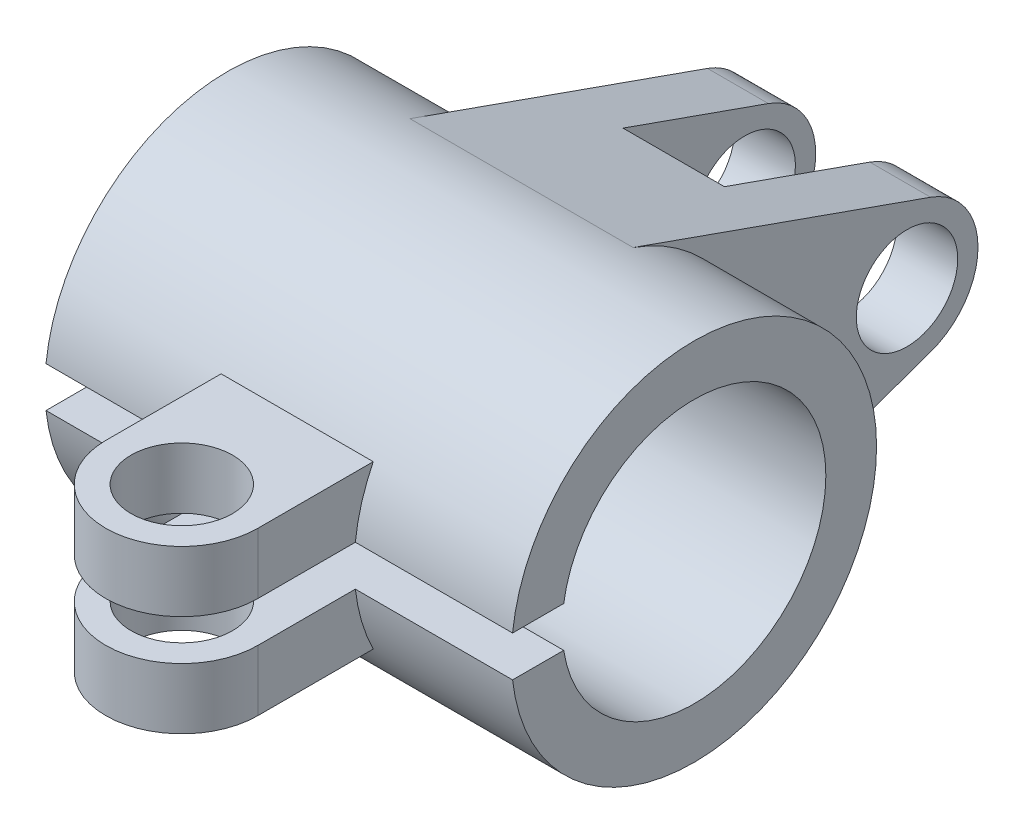
from build123d import *

# Parameters (mm, degrees)
BOSS_EXTRUDE1_DEPTH    = 23
BOSS_EXTRUDE2_DEPTH    = 11
BOSS_EXTRUDE3_START    = 5
SKETCH1_4_R            = 5.000000000000004
BOSS_EXTRUDE3_DEPTH    = 6
BOSS_EXTRUDE4_START    = -11
SKETCH1_5_R            = 5.000000000000004
BOSS_EXTRUDE4_DEPTH    = 6
BOSS_EXTRUDE5_DEPTH    = 7.5
FILLET1_RADIUS         = 7.5
FILLET1_LENGTH         = 6
FILLET2_RADIUS         = 7.5
FILLET2_LENGTH         = 6
F_10_0MM_DOWEL_HOLE1_D = 10


with BuildPart() as part:
    # Sketch1 → Boss-Extrude1 (new, symmetric)
    with BuildSketch(Plane(origin=(0, 0, 0), x_dir=(0, 0, -1), z_dir=(1, 0, 0))):
        with BuildLine():
            ThreePointArc((18, 0), (14.696938456699069, 10.392304845413266), (5.999999999999998, 16.97056274847714))
            ThreePointArc((5.999999999999998, 16.97056274847714), (-6.763446053329629, 16.68100109357049), (-16.1245154965971, 8.000000000000002))
            ThreePointArc((-16.1245154965971, 8.000000000000002), (-17.269106839051002, 5.077198930654761), (-17.888543819998286, 2.0000000000002958))
            Line((-17.888543819998254, 1.9999999999999998), (-12.845232578665128, 2.0000000000000004))
            ThreePointArc((-12.845232578665128, 2.0000000000000018), (1.0029896503337725, 12.96125039343517), (13, 0))
            ThreePointArc((13, -3.18e-15), (1.0029896503337692, -12.96125039343517), (-12.84523257866513, -1.9999999999999987))
            Line((-12.845232578665128, -2.0000000000000004), (-17.888543819998254, -1.9999999999999998))
            ThreePointArc((-17.888543819998286, -2.0000000000002918), (-17.269106839051005, -5.077198930654757), (-16.124515496597102, -7.999999999999997))
            ThreePointArc((-16.124515496597102, -7.999999999999997), (-6.763446053329637, -16.681001093570487), (5.999999999999995, -16.970562748477143))
            ThreePointArc((5.999999999999995, -16.970562748477143), (14.69693845669907, -10.39230484541326), (18, -4.41e-15))
        make_face()
    extrude(amount=BOSS_EXTRUDE1_DEPTH, both=True)

    # Sketch1<3> → Boss-Extrude2 (add, symmetric)
    with BuildSketch(Plane(origin=(0, 0, 0), x_dir=(0, 0, -1), z_dir=(1, 0, 0))):
        with BuildLine():
            Line((21.000000000000004, 11.667261889578032), (6, 16.97056274847714))
            ThreePointArc((5.999999999999998, 16.97056274847714), (14.696938456699069, 10.392304845413266), (18, 0))
            ThreePointArc((18, -4.41e-15), (14.69693845669907, -10.39230484541326), (5.999999999999995, -16.970562748477143))
            Line((6, -16.97056274847714), (21.000000000000004, -11.667261889578032))
            Line((21.000000000000004, -11.66726188957803), (21.000000000000004, 11.66726188957803))
        make_face()
    extrude(amount=BOSS_EXTRUDE2_DEPTH, both=True)

    # Sketch1<4> → Boss-Extrude3 (add)
    with BuildSketch(Plane(origin=(0, 0, 0), x_dir=(0, 0, -1), z_dir=(1, 0, 0)).offset(BOSS_EXTRUDE3_START)):
        with BuildLine():
            Line((35.333333333333336, 6.599663291074442), (21.000000000000004, 11.667261889578032))
            Line((21.000000000000004, 11.66726188957803), (21.000000000000004, -11.66726188957803))
            Line((21.000000000000004, -11.667261889578032), (35.333333333333336, -6.599663291074442))
            ThreePointArc((35.333333333333336, -6.59966329107444), (40, -2.2e-16), (35.333333333333336, 6.5996632910744415))
        make_face()
        with Locations((33, 0)):
            Circle(SKETCH1_4_R, mode=Mode.SUBTRACT)
    extrude(amount=BOSS_EXTRUDE3_DEPTH)

    # Sketch1<5> → Boss-Extrude4 (add)
    with BuildSketch(Plane(origin=(0, 0, 0), x_dir=(0, 0, -1), z_dir=(1, 0, 0)).offset(BOSS_EXTRUDE4_START)):
        with BuildLine():
            Line((35.333333333333336, 6.599663291074442), (21.000000000000004, 11.667261889578032))
            Line((21.000000000000004, 11.66726188957803), (21.000000000000004, -11.66726188957803))
            Line((21.000000000000004, -11.667261889578032), (35.333333333333336, -6.599663291074442))
            ThreePointArc((35.333333333333336, -6.59966329107444), (40, -2.2e-16), (35.333333333333336, 6.5996632910744415))
        make_face()
        with Locations((33, 0)):
            Circle(SKETCH1_5_R, mode=Mode.SUBTRACT)
    extrude(amount=BOSS_EXTRUDE4_DEPTH)

    # Sketch1<7> → Boss-Extrude5 (add, symmetric)
    with BuildSketch(Plane(origin=(0, 0, 0), x_dir=(0, 0, -1), z_dir=(1, 0, 0))):
        with BuildLine():
            Line((-35, -7.999999999999998), (-16.1245154965971, -7.9999999999999964))
            ThreePointArc((-16.124515496597102, -7.999999999999997), (-17.269106839051005, -5.077198930654757), (-17.888543819998286, -2.0000000000002918))
            Line((-17.888543819998254, -1.9999999999999998), (-35, -1.9999999999999973))
            Line((-35, -1.9999999999999973), (-35, -7.999999999999998))
        make_face()
        with BuildLine():
            ThreePointArc((-17.888543819998286, 2.0000000000002958), (-17.269106839051002, 5.077198930654761), (-16.1245154965971, 8.000000000000002))
            Line((-16.1245154965971, 7.9999999999999964), (-35, 7.999999999999998))
            Line((-35, 7.999999999999998), (-35, 1.9999999999999973))
            Line((-35, 1.9999999999999973), (-17.888543819998254, 1.9999999999999998))
        make_face()
    extrude(amount=BOSS_EXTRUDE5_DEPTH, both=True)

    # Fillet1: full round fillet: the end face becomes a half cylinder, R = half its width
    fillet1_face = Plane((0, -5, 35), x_dir=(0, -1, 0), z_dir=(0, 0, 1))  # on the end face: x along it, z out of the body
    fillet1_slab = fillet1_face.offset(-FILLET1_RADIUS / 2) * Box(FILLET1_LENGTH, 2 * FILLET1_RADIUS, FILLET1_RADIUS, mode=Mode.PRIVATE)  # the body's end, R deep
    fillet1_round = Plane((0, -5, 27.5), x_dir=(0, 0, 1), z_dir=(0, -1, 0)) * Cylinder(FILLET1_RADIUS, FILLET1_LENGTH, mode=Mode.PRIVATE)  # its axis R under the face
    add(fillet1_slab - fillet1_round, mode=Mode.SUBTRACT)

    # Fillet2: full round fillet: the end face becomes a half cylinder, R = half its width
    fillet2_face = Plane((0, 5, 35), x_dir=(0, -1, 0), z_dir=(0, 0, 1))  # on the end face: x along it, z out of the body
    fillet2_slab = fillet2_face.offset(-FILLET2_RADIUS / 2) * Box(FILLET2_LENGTH, 2 * FILLET2_RADIUS, FILLET2_RADIUS, mode=Mode.PRIVATE)  # the body's end, R deep
    fillet2_round = Plane((0, 5, 27.5), x_dir=(0, 0, 1), z_dir=(0, -1, 0)) * Cylinder(FILLET2_RADIUS, FILLET2_LENGTH, mode=Mode.PRIVATE)  # its axis R under the face
    add(fillet2_slab - fillet2_round, mode=Mode.SUBTRACT)

    # Ø10.0mm Dowel Hole1 (through all)
    with Locations(Plane(origin=(0, -8, 27.5), x_dir=(0, 0, -1), z_dir=(0, -1, 0))):
        with Locations((0, 0)):
            Hole(F_10_0MM_DOWEL_HOLE1_D / 2)


solid = part.part
